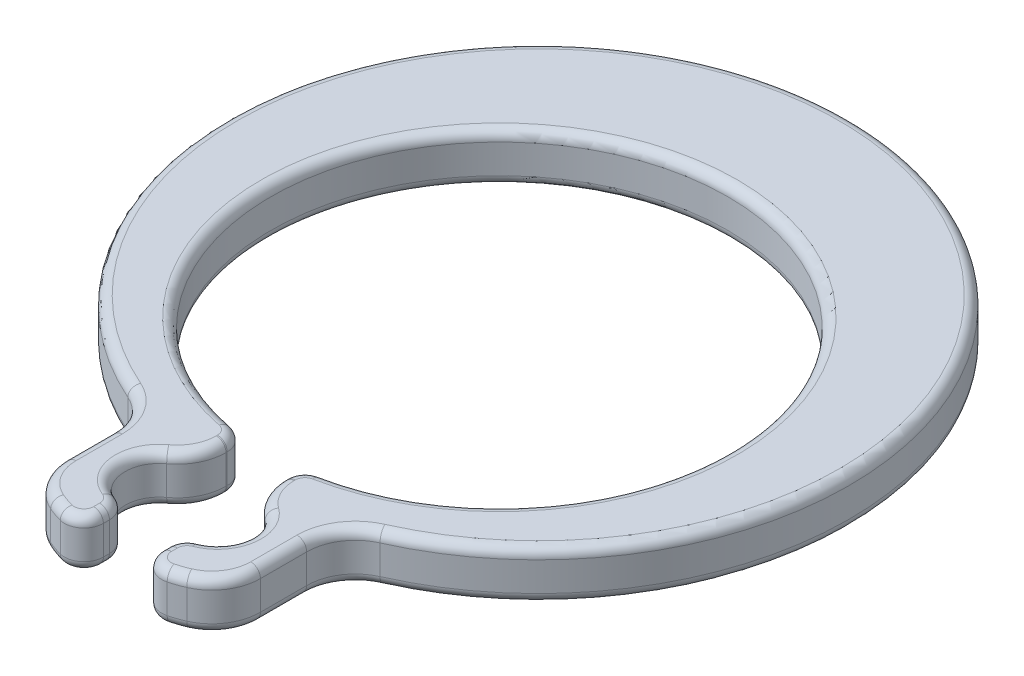
from build123d import *

# Parameters (mm, degrees)
EXTRUDE_1_DEPTH = 0.5
FILLET_3_R      = 0.5
FILLET_4_R      = 0.2
FILLET_5_R      = 0.1


with BuildPart() as part:
    # 草图1 → 凸台-拉伸1 (new body)
    with BuildSketch(Plane(origin=(0, 0, 0), x_dir=(1, 0, 0), z_dir=(0, 1, 0))):
        with BuildLine():
            Line((0.3, -2.330772404), (0.3, -2.85))
            ThreePointArc((0.3, -2.85), (0.65, -3.2), (0.3, -3.55))
            Line((0.3, -3.55), (0.3, -4))
            ThreePointArc((0.3, -4), (0.678058962, -3.925781519), (1, -3.714142843))
            Line((1, -3.714142843), (1, -2.639736831))
            ThreePointArc((1, -2.639736831), (0, 3.6), (-1, -2.639736831))
            Line((-1, -2.639736831), (-1, -3.714142843))
            ThreePointArc((-1, -3.714142843), (-0.678058962, -3.925781519), (-0.3, -4))
            Line((-0.3, -4), (-0.3, -3.55))
            ThreePointArc((-0.3, -3.55), (-0.65, -3.2), (-0.3, -2.85))
            Line((-0.3, -2.85), (-0.3, -2.330772404))
            ThreePointArc((-0.3, -2.330772404), (0, 2.35), (0.3, -2.330772404))
        make_face()
    extrude(amount=EXTRUDE_1_DEPTH)

    # 圆角3
    fillet_3_edges = [part.edges().sort_by_distance(p)[0] for p in [
        (1, 0.25, 2.639736831),
        (1, 0.25, 3.714142843),
        (0.3, 0.25, 2.85),
        (-0.3, 0.25, 2.85),
        (-1, 0.25, 3.714142843),
        (-1, 0.25, 2.639736831),
    ]]
    fillet(fillet_3_edges, radius=FILLET_3_R)

    # 圆角4
    fillet_4_edges = [part.edges().sort_by_distance(p)[0] for p in [
        (0.3, 0.25, 4),
        (0.3, 0.25, 3.55),
        (0.3, 0.25, 2.330772404),
        (-0.3, 0.25, 2.330772404),
        (-0.3, 0.25, 3.55),
        (-0.3, 0.25, 4),
    ]]
    fillet(fillet_4_edges, radius=FILLET_4_R)

    # 圆角5
    fillet_5_edges = [part.edges().sort_by_distance(p)[0] for p in [
        (-0.3, 0, 2.506556798),
        (-0.3, 0.5, 2.506556798),
        (0, 0, -3.6),
        (1, 0, 3.220282237),
        (0.647120911, 0, 3.244800371),
        (-0.626027631, 0, 3.94536024),
        (-1, 0, 3.220282237),
        (-0.918330013, 0, 3.732118848),
        (0.918330013, 0, 3.732118848),
        (0.354433606, 0, 2.739484949),
        (-0.354433606, 0, 2.739484949),
        (0, 0.5, -3.6),
        (-1, 0.5, 3.220282237),
        (-0.626027631, 0.5, 3.94536024),
        (0.647120911, 0.5, 3.244800371),
        (1, 0.5, 3.220282237),
        (-0.918330013, 0.5, 3.732118848),
        (0.918330013, 0.5, 3.732118848),
        (0.354433606, 0.5, 2.739484949),
        (-0.354433606, 0.5, 2.739484949),
        (-1.080863178, 0, 2.709682027),
        (-1.080863178, 0.5, 2.709682027),
        (1.080863178, 0, 2.709682027),
        (1.080863178, 0.5, 2.709682027),
        (0, 0, -2.35),
        (0, 0.5, -2.35),
        (-0.647120911, 0, 3.244800371),
        (-0.3, 0, 3.743472104),
        (0.626027631, 0, 3.94536024),
        (0.3, 0, 3.743472104),
        (0.3, 0, 2.506556798),
        (0.377525513, 0, 3.932710552),
        (-0.377525513, 0, 3.932710552),
        (-0.334855435, 0, 3.599532323),
        (0.334855435, 0, 3.599532323),
        (0.345334009, 0, 2.373699195),
        (-0.345334009, 0, 2.373699195),
        (-0.647120911, 0.5, 3.244800371),
        (0.3, 0.5, 2.506556798),
        (0.3, 0.5, 3.743472104),
        (0.626027631, 0.5, 3.94536024),
        (-0.3, 0.5, 3.743472104),
        (0.377525513, 0.5, 3.932710552),
        (-0.377525513, 0.5, 3.932710552),
        (-0.334855435, 0.5, 3.599532323),
        (0.334855435, 0.5, 3.599532323),
        (0.345334009, 0.5, 2.373699195),
        (-0.345334009, 0.5, 2.373699195),
    ]]
    fillet(fillet_5_edges, radius=FILLET_5_R)


solid = part.part
